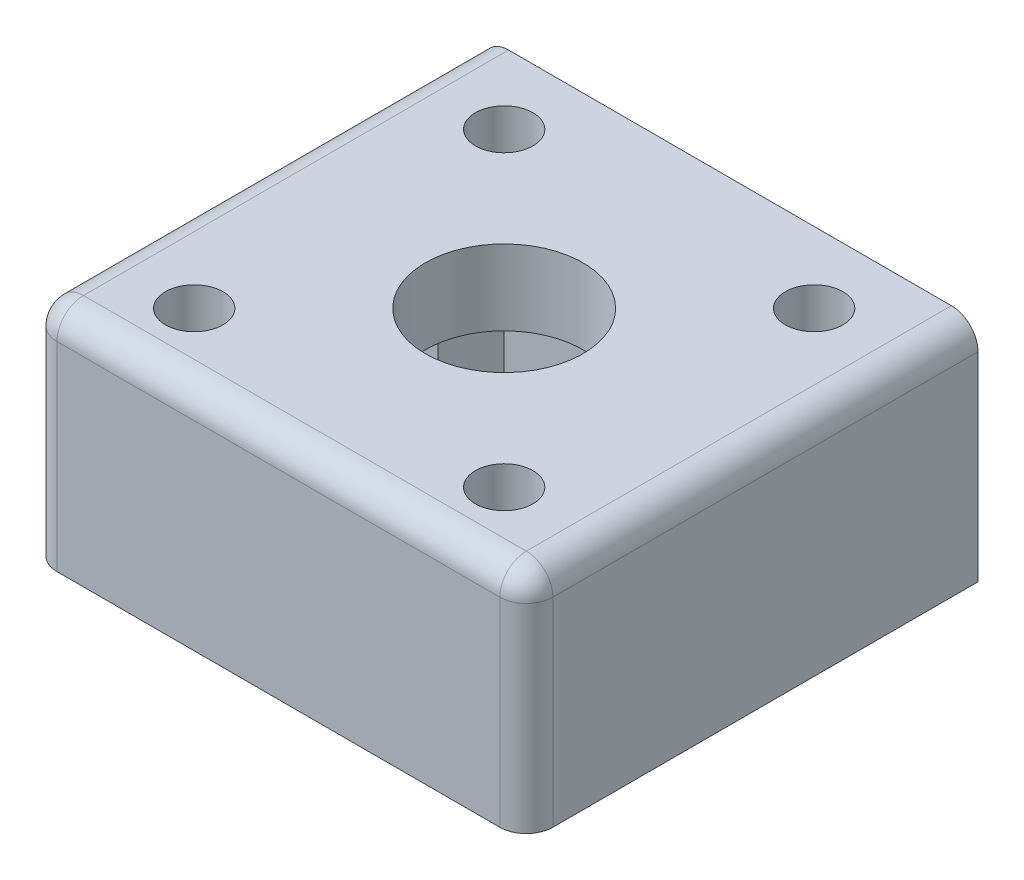
from build123d import *

# Parameters (mm, degrees)
SKETCH1_W                      = 56
SKETCH1_H                      = 51
BOSS_EXTRUDE1_DEPTH            = 17
SKETCH2_W                      = 56
SKETCH2_H                      = 51
SKETCH2_R                      = 8.9
BOSS_EXTRUDE2_DEPTH            = 8.5
CBORE_FOR_M3_SHCS1_D           = 3.6
CBORE_FOR_M3_SHCS1_CBORE_D     = 6.5
CBORE_FOR_M3_SHCS1_CBORE_DEPTH = 23
FILLET3_R                      = 3
M2_5X0_45_TAPPED_HOLE1_D       = 2.05
M2_5X0_45_TAPPED_HOLE1_DEPTH   = 10
M2_5X0_45_TAPPED_HOLE1_TIP     = 0.615882135
FILLET4_R                      = 3


with BuildPart() as part:
    # Sketch1 → Boss-Extrude1 (new body)
    with BuildSketch(Plane(origin=(0, 0, 0), x_dir=(1, 0, 0), z_dir=(0, 1, 0))):
        Rectangle(SKETCH1_W, SKETCH1_H)
        Polygon((15, -15), (-15, -15), (-15, -7.5), (-20, -7.5), (-20, 7.5), (-15, 7.5), (-15, 15), (15, 15), (15, 7.5), (20, 7.5), (20, -7.5), (15, -7.5), align=None, mode=Mode.SUBTRACT)
    extrude(amount=BOSS_EXTRUDE1_DEPTH)

    # Sketch2 → Boss-Extrude2 (add)
    with BuildSketch(Plane(origin=(0, 17, 0), x_dir=(1, 0, 0), z_dir=(0, 1, 0))):
        Rectangle(SKETCH2_W, SKETCH2_H)
        with Locations(Location((0, 0, 0), (0, 0, 270))):
            Circle(SKETCH2_R, mode=Mode.SUBTRACT)
    extrude(amount=BOSS_EXTRUDE2_DEPTH)

    # CBORE for M3 SHCS1 (through all)
    with Locations(Plane(origin=(0, 25.5, 0), x_dir=(1, 0, 0), z_dir=(0, 1, 0))):
        with Locations((-17.5, 17.5), (17.5, 17.5), (17.5, -17.5), (-17.5, -17.5)):
            CounterBoreHole(CBORE_FOR_M3_SHCS1_D / 2, CBORE_FOR_M3_SHCS1_CBORE_D / 2, CBORE_FOR_M3_SHCS1_CBORE_DEPTH)

    # Fillet3
    fillet3_edges = [part.edges().sort_by_distance(p)[0] for p in [
        (-28, 25.5, 0),
        (28, 25.5, 0),
    ]]
    fillet(fillet3_edges, radius=FILLET3_R)

    # M2.5x0.45 Tapped Hole1
    with Locations(Plane(origin=(0, 0, -25.5), x_dir=(-1, 0, 0), z_dir=(0, 0, -1))):
        with Locations((-23, 20.5), (23, 20.5), (-23, 5), (23, 5)):
            Hole(M2_5X0_45_TAPPED_HOLE1_D / 2, depth=M2_5X0_45_TAPPED_HOLE1_DEPTH)
            with Locations((0, 0, -(M2_5X0_45_TAPPED_HOLE1_DEPTH + M2_5X0_45_TAPPED_HOLE1_TIP / 2))):  # 118° drill point
                Cone(0, M2_5X0_45_TAPPED_HOLE1_D / 2, M2_5X0_45_TAPPED_HOLE1_TIP, mode=Mode.SUBTRACT)

    # Fillet4
    fillet4_edges = [part.edges().sort_by_distance(p)[0] for p in [
        (28, 11.25, 25.5),
        (-28, 11.25, 25.5),
        (-27.121320344, 24.621320344, 25.5),
        (27.121320344, 24.621320344, 25.5),
        (0, 25.5, 25.5),
    ]]
    fillet(fillet4_edges, radius=FILLET4_R)


solid = part.part
